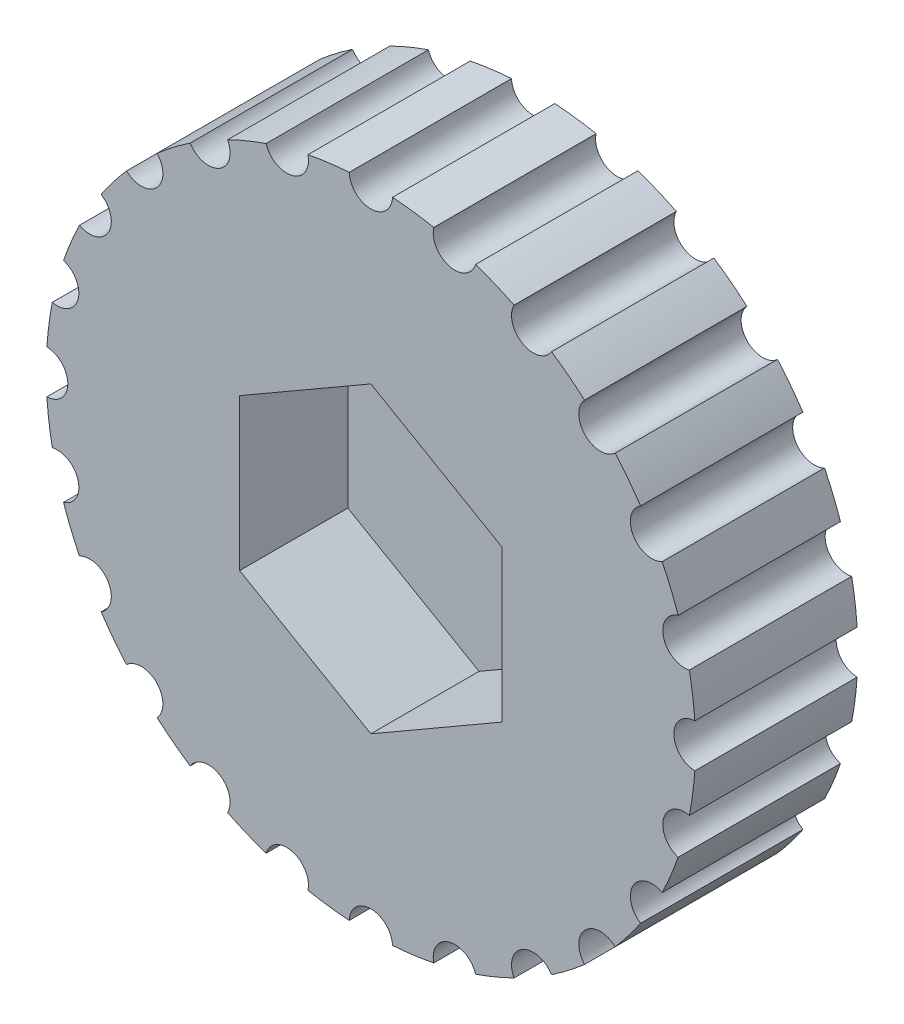
from build123d import *

# Parameters (mm, degrees)
SKETCH1_R           = 30
BOSS_EXTRUDE1_DEPTH = 15
CUT_EXTRUDE1_DEPTH  = 10
SKETCH3_R           = 2
CUT_EXTRUDE2_DEPTH  = 46


with BuildPart() as part:
    # Sketch1 → Boss-Extrude1 (new body)
    with BuildSketch(Plane.XY):
        Circle(SKETCH1_R)
    extrude(amount=BOSS_EXTRUDE1_DEPTH)

    # Sketch2 → Cut-Extrude1 (cut)
    with BuildSketch(Plane.XY.offset(15)):
        Polygon((0, 14), (-12.124355653, 7), (-12.124355653, -7), (0, -14), (12.124355653, -7), (12.124355653, 7), align=None)
    extrude(amount=-CUT_EXTRUDE1_DEPTH, mode=Mode.SUBTRACT)

    # Sketch3 → Cut-Extrude2 (cut, through all)
    with BuildSketch(Plane(origin=(0, 0, 0), x_dir=(-1, 0, 0), z_dir=(0, 0, -1))):
        with Locations((0, 30)):
            Circle(SKETCH3_R)
        with Locations((7.764571353, 28.977774789)):
            Circle(SKETCH3_R)
        with Locations((15, 25.980762114)):
            Circle(SKETCH3_R)
        with Locations((21.213203436, 21.213203436)):
            Circle(SKETCH3_R)
        with Locations((25.980762114, 15)):
            Circle(SKETCH3_R)
        with Locations((28.977774789, 7.764571353)):
            Circle(SKETCH3_R)
        with Locations((30, 0)):
            Circle(SKETCH3_R)
        with Locations((28.977774789, -7.764571353)):
            Circle(SKETCH3_R)
        with Locations((25.980762114, -15)):
            Circle(SKETCH3_R)
        with Locations((21.213203436, -21.213203436)):
            Circle(SKETCH3_R)
        with Locations((15, -25.980762114)):
            Circle(SKETCH3_R)
        with Locations((7.764571353, -28.977774789)):
            Circle(SKETCH3_R)
        with Locations((0, -30)):
            Circle(SKETCH3_R)
        with Locations((-7.764571353, -28.977774789)):
            Circle(SKETCH3_R)
        with Locations((-15, -25.980762114)):
            Circle(SKETCH3_R)
        with Locations((-21.213203436, -21.213203436)):
            Circle(SKETCH3_R)
        with Locations((-25.980762114, -15)):
            Circle(SKETCH3_R)
        with Locations((-28.977774789, -7.764571353)):
            Circle(SKETCH3_R)
        with Locations((-30, 0)):
            Circle(SKETCH3_R)
        with Locations((-28.977774789, 7.764571353)):
            Circle(SKETCH3_R)
        with Locations((-25.980762114, 15)):
            Circle(SKETCH3_R)
        with Locations((-21.213203436, 21.213203436)):
            Circle(SKETCH3_R)
        with Locations((-15, 25.980762114)):
            Circle(SKETCH3_R)
        with Locations((-7.764571353, 28.977774789)):
            Circle(SKETCH3_R)
    extrude(amount=-CUT_EXTRUDE2_DEPTH, mode=Mode.SUBTRACT)


solid = part.part
